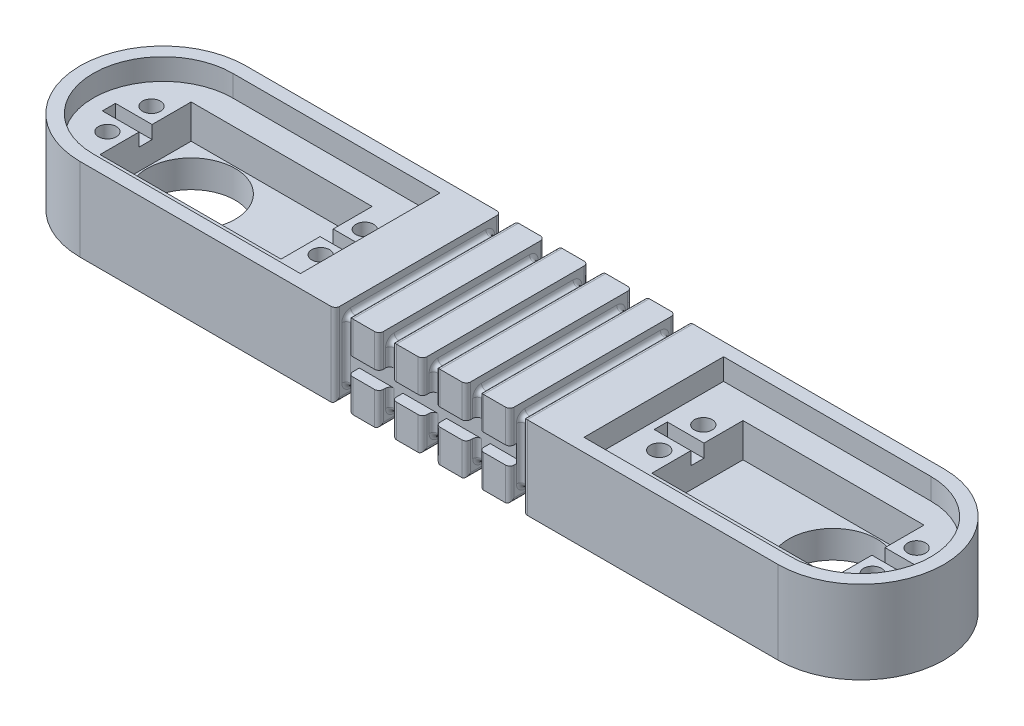
from build123d import *

# Parameters (mm, degrees)
EXTRUDE_1_DEPTH                    = 9.5
SKETCH_2_R                         = 2.05
SKETCH_2_W                         = 41.5
SKETCH_2_H                         = 20.9
CUT_EXTRUDE_1_DEPTH                = 4.9
SKETCH_2_3_W                       = 41.5
SKETCH_2_3_H                       = 20.9
SKETCH_2_3_R                       = 10.1
CUT_EXTRUDE_2_DEPTH                = 12.7
SKETCH_2_4_R                       = 2.05
SKETCH_2_4_R_2                     = 10.1
CUT_EXTRUDE_3_DEPTH                = 103.581674777
CUT_EXTRUDE_4_DEPTH                = 3.2
SKETCH_4_W                         = 8.4
SKETCH_4_H                         = 3
CUT_EXTRUDE_5_DEPTH                = 3
SKETCH_5_W                         = 38
SKETCH_5_H                         = 19
SKETCH_5_W_2                       = 33
SKETCH_5_H_2                       = 14
CUT_EXTRUDE_6_DEPTH                = 1.5
FILLET_1_R                         = 1
PATTERN_LINEAR_1_COUNT             = 3
PATTERN_LINEAR_1_PITCH             = 10
FILLET_1_OF_PATTERN_LINEAR_1_R     = 1
PATTERN_LINEAR_1_COL_COUNT         = 3
PATTERN_LINEAR_1_COL_PITCH         = 10
FILLET_1_OF_PATTERN_LINEAR_1_COL_R = 1
SKETCH_6_W                         = 37
SKETCH_6_H                         = 4
CUT_EXTRUDE_7_DEPTH                = 2.5


with BuildPart() as part:
    # 草图1 → 凸台-拉伸1 (new, symmetric)
    with BuildSketch(Plane(origin=(0, 0, 0), x_dir=(1, 0, 0), z_dir=(0, 1, 0))):
        with BuildLine():
            Line((-80, 19), (80, 19))
            ThreePointArc((80, 19), (99, 0), (80, -19))
            Line((80, -19), (-80, -19))
            ThreePointArc((-80, -19), (-99, 0), (-80, 19))
        make_face()
    extrude(amount=EXTRUDE_1_DEPTH, both=True)

    # 草图2 → 切除-拉伸1 (cut)
    # profile 1 of 2: a face of its own
    with BuildSketch(Plane(origin=(0, 9.5, 0), x_dir=(1, 0, 0), z_dir=(0, 1, 0))):
        with BuildLine():
            Line((-80, 16), (-32.5, 16))
            Line((-32.5, 16), (-32.5, -16))
            Line((-32.5, -16), (-80, -16))
            ThreePointArc((-80, -16), (-96, 0), (-80, 16))
        make_face()
        with Locations(Location((-38.8, -5.05, 0), (0, 0, 270))):
            Circle(SKETCH_2_R, mode=Mode.SUBTRACT)
        with Locations(Location((-38.8, 5.05, 0), (0, 0, 270))):
            Circle(SKETCH_2_R, mode=Mode.SUBTRACT)
        with Locations(Location((-87.7, -5.05, 0), (0, 0, 270))):
            Circle(SKETCH_2_R, mode=Mode.SUBTRACT)
        with Locations(Location((-87.7, 5.05, 0), (0, 0, 270))):
            Circle(SKETCH_2_R, mode=Mode.SUBTRACT)
        with Locations((-63.25, 0)):
            Rectangle(SKETCH_2_W, SKETCH_2_H, mode=Mode.SUBTRACT)
    # profile 2 of 2: a face of its own
    with BuildSketch(Plane(origin=(0, 9.5, 0), x_dir=(1, 0, 0), z_dir=(0, 1, 0))):
        with BuildLine():
            ThreePointArc((80, 16), (96, 0), (80, -16))
            Line((80, -16), (32.5, -16))
            Line((32.5, -16), (32.5, 16))
            Line((32.5, 16), (80, 16))
        make_face()
        with Locations(Location((87.7, -5.05, 0), (0, 0, 270))):
            Circle(SKETCH_2_R, mode=Mode.SUBTRACT)
        with Locations(Location((87.7, 5.05, 0), (0, 0, 270))):
            Circle(SKETCH_2_R, mode=Mode.SUBTRACT)
        with Locations(Location((38.8, -5.05, 0), (0, 0, 270))):
            Circle(SKETCH_2_R, mode=Mode.SUBTRACT)
        with Locations(Location((38.8, 5.05, 0), (0, 0, 270))):
            Circle(SKETCH_2_R, mode=Mode.SUBTRACT)
        with Locations((63.25, 0)):
            Rectangle(SKETCH_2_W, SKETCH_2_H, mode=Mode.SUBTRACT)
    extrude(amount=-CUT_EXTRUDE_1_DEPTH, mode=Mode.SUBTRACT)

    # 草图2<3> → 切除-拉伸2 (cut)
    # profile 1 of 2: a face of its own
    with BuildSketch(Plane(origin=(0, 9.5, 0), x_dir=(1, 0, 0), z_dir=(0, 1, 0))):
        with Locations((-63.25, 0)):
            Rectangle(SKETCH_2_3_W, SKETCH_2_3_H)
        with Locations(Location((-73.55, 0, 0), (0, 0, 270))):
            Circle(SKETCH_2_3_R, mode=Mode.SUBTRACT)
    # profile 2 of 2: a face of its own
    with BuildSketch(Plane(origin=(0, 9.5, 0), x_dir=(1, 0, 0), z_dir=(0, 1, 0))):
        with Locations((63.25, 0)):
            Rectangle(SKETCH_2_3_W, SKETCH_2_3_H)
        with Locations(Location((73.55, 0, 0), (0, 0, 270))):
            Circle(SKETCH_2_3_R, mode=Mode.SUBTRACT)
    extrude(amount=-CUT_EXTRUDE_2_DEPTH, mode=Mode.SUBTRACT)

    # 草图2<4> → 切除-拉伸3 (cut, through all)
    with BuildSketch(Plane(origin=(0, 9.5, 0), x_dir=(1, 0, 0), z_dir=(0, 1, 0))):
        with Locations(Location((-87.7, 5.05, 0), (0, 0, 270))):
            Circle(SKETCH_2_4_R)
        with Locations(Location((-87.7, -5.05, 0), (0, 0, 270))):
            Circle(SKETCH_2_4_R)
        with Locations(Location((-73.55, 0, 0), (0, 0, 270))):
            Circle(SKETCH_2_4_R_2)
        with Locations(Location((-38.8, 5.05, 0), (0, 0, 270))):
            Circle(SKETCH_2_4_R)
        with Locations(Location((-38.8, -5.05, 0), (0, 0, 270))):
            Circle(SKETCH_2_4_R)
        with Locations(Location((38.8, 5.05, 0), (0, 0, 270))):
            Circle(SKETCH_2_4_R)
        with Locations(Location((38.8, -5.05, 0), (0, 0, 270))):
            Circle(SKETCH_2_4_R)
        with Locations(Location((73.55, 0, 0), (0, 0, 270))):
            Circle(SKETCH_2_4_R_2)
        with Locations(Location((87.7, 5.05, 0), (0, 0, 270))):
            Circle(SKETCH_2_4_R)
        with Locations(Location((87.7, -5.05, 0), (0, 0, 270))):
            Circle(SKETCH_2_4_R)
    extrude(amount=-CUT_EXTRUDE_3_DEPTH, mode=Mode.SUBTRACT)

    # 草图3 → 切除-拉伸4 (cut)
    with BuildSketch(Plane.XZ.offset(9.5)):
        Polygon((-85.082857517, -1.970406105), (-83.724422212, -5.776714929), (-86.341564696, -8.856308823), (-90.317142483, -8.129593895), (-91.675577788, -4.323285071), (-89.058435304, -1.243691177), align=None)
        Polygon((-83.724422212, 5.776714929), (-86.341564696, 8.856308823), (-90.317142483, 8.129593895), (-91.675577788, 4.323285071), (-89.058435304, 1.243691177), (-85.082857517, 1.970406105), align=None)
        Polygon((83.724422212, -5.776714929), (86.341564696, -8.856308823), (90.317142483, -8.129593895), (91.675577788, -4.323285071), (89.058435304, -1.243691177), (85.082857517, -1.970406105), align=None)
        Polygon((85.082857517, 1.970406105), (83.724422212, 5.776714929), (86.341564696, 8.856308823), (90.317142483, 8.129593895), (91.675577788, 4.323285071), (89.058435304, 1.243691177), align=None)
        Polygon((-34.758548116, -5.05), (-36.779274058, -8.55), (-40.820725942, -8.55), (-42.841451884, -5.05), (-40.820725942, -1.55), (-36.779274058, -1.55), align=None)
        Polygon((-36.779274058, 8.55), (-40.820725942, 8.55), (-42.841451884, 5.05), (-40.820725942, 1.55), (-36.779274058, 1.55), (-34.758548116, 5.05), align=None)
        Polygon((36.779274058, -8.55), (40.820725942, -8.55), (42.841451884, -5.05), (40.820725942, -1.55), (36.779274058, -1.55), (34.758548116, -5.05), align=None)
        Polygon((34.758548116, 5.05), (36.779274058, 8.55), (40.820725942, 8.55), (42.841451884, 5.05), (40.820725942, 1.55), (36.779274058, 1.55), align=None)
    extrude(amount=-CUT_EXTRUDE_4_DEPTH, mode=Mode.SUBTRACT)

    # 草图4 → 切除-拉伸5 (cut)
    with BuildSketch(Plane(origin=(0, 4.6, 0), x_dir=(1, 0, 0), z_dir=(0, 1, 0))):
        with Locations((-38.3, 0)):
            Rectangle(SKETCH_4_W, SKETCH_4_H)
        with Locations((-88.2, 0)):
            Rectangle(SKETCH_4_W, SKETCH_4_H)
        with Locations((88.2, 0)):
            Rectangle(SKETCH_4_W, SKETCH_4_H)
        with Locations((38.3, 0)):
            Rectangle(SKETCH_4_W, SKETCH_4_H)
    extrude(amount=-CUT_EXTRUDE_5_DEPTH, mode=Mode.SUBTRACT)

    # 草图5 → 切除-拉伸6 (cut, symmetric)
    with BuildSketch(Plane(origin=(0, 0, 0), x_dir=(0, 0, -1), z_dir=(1, 0, 0))):
        Rectangle(SKETCH_5_W, SKETCH_5_H)
        Rectangle(SKETCH_5_W_2, SKETCH_5_H_2, mode=Mode.SUBTRACT)
    cut_extrude_6 = extrude(amount=CUT_EXTRUDE_6_DEPTH, both=True, mode=Mode.SUBTRACT)

    # 圆角1
    fillet_1_edges = [part.edges().sort_by_distance(p)[0] for p in [
        (-1.5, 0, 19),
        (-1.5, 0, -19),
        (-1.5, -9.5, 0),
        (-1.5, 7, 0),
        (-1.5, 0, 16.5),
        (-1.5, -7, 0),
        (-1.5, 0, -16.5),
        (1.5, 0, 19),
        (1.5, -9.5, 0),
        (1.5, 0, -19),
        (1.5, 9.5, 0),
        (0, 7, 16.5),
        (0, 7, -16.5),
        (0, -7, -16.5),
        (0, -7, 16.5),
    ]]
    fillet(fillet_1_edges, radius=FILLET_1_R)

    # 阵列(线性)1: 切除-拉伸6 ×3
    with Locations(*[(-i * PATTERN_LINEAR_1_PITCH, 0, 0) for i in range(1, PATTERN_LINEAR_1_COUNT)]):
        add(cut_extrude_6, mode=Mode.SUBTRACT)

    # 圆角1 of 阵列(线性)1
    fillet_1_of_pattern_linear_1_edges = [part.edges().sort_by_distance(p)[0] for p in [
        (-11.5, 0, 19),
        (-11.5, 0, -19),
        (-11.5, -9.5, 0),
        (-11.5, 7, 0),
        (-11.5, 0, 16.5),
        (-11.5, -7, 0),
        (-11.5, 0, -16.5),
        (-8.5, 0, 19),
        (-8.5, -9.5, 0),
        (-8.5, 0, -19),
        (-8.5, 9.5, 0),
        (-10, 7, 16.5),
        (-10, 7, -16.5),
        (-10, -7, -16.5),
        (-10, -7, 16.5),
        (-21.5, 0, 19),
        (-21.5, 0, -19),
        (-21.5, -9.5, 0),
        (-21.5, 7, 0),
        (-21.5, 0, 16.5),
        (-21.5, -7, 0),
        (-21.5, 0, -16.5),
        (-18.5, 0, 19),
        (-18.5, -9.5, 0),
        (-18.5, 0, -19),
        (-18.5, 9.5, 0),
        (-20, 7, 16.5),
        (-20, 7, -16.5),
        (-20, -7, -16.5),
        (-20, -7, 16.5),
    ]]
    fillet(fillet_1_of_pattern_linear_1_edges, radius=FILLET_1_OF_PATTERN_LINEAR_1_R)

    # 阵列(线性)1 col: 切除-拉伸6 ×3
    with Locations(*[(i * PATTERN_LINEAR_1_COL_PITCH, 0, 0) for i in range(1, PATTERN_LINEAR_1_COL_COUNT)]):
        add(cut_extrude_6, mode=Mode.SUBTRACT)

    # 圆角1 of 阵列(线性)1 col
    fillet_1_of_pattern_linear_1_col_edges = [part.edges().sort_by_distance(p)[0] for p in [
        (8.5, 0, 19),
        (8.5, 0, -19),
        (8.5, -9.5, 0),
        (8.5, 7, 0),
        (8.5, 0, 16.5),
        (8.5, -7, 0),
        (8.5, 0, -16.5),
        (11.5, 0, 19),
        (11.5, -9.5, 0),
        (11.5, 0, -19),
        (11.5, 9.5, 0),
        (10, 7, 16.5),
        (10, 7, -16.5),
        (10, -7, -16.5),
        (10, -7, 16.5),
        (18.5, 0, 19),
        (18.5, 0, -19),
        (18.5, -9.5, 0),
        (18.5, 7, 0),
        (18.5, 0, 16.5),
        (18.5, -7, 0),
        (18.5, 0, -16.5),
        (21.5, 0, 19),
        (21.5, -9.5, 0),
        (21.5, 0, -19),
        (21.5, 9.5, 0),
        (20, 7, 16.5),
        (20, 7, -16.5),
        (20, -7, -16.5),
        (20, -7, 16.5),
    ]]
    fillet(fillet_1_of_pattern_linear_1_col_edges, radius=FILLET_1_OF_PATTERN_LINEAR_1_COL_R)

    # 草图6 → 切除-拉伸7 (cut)
    with BuildSketch(Plane(origin=(0, 0, -19), x_dir=(-1, 0, 0), z_dir=(0, 0, -1))):
        Rectangle(SKETCH_6_W, SKETCH_6_H)
    cut_extrude_7 = extrude(amount=-CUT_EXTRUDE_7_DEPTH, mode=Mode.SUBTRACT)

    # 镜向2: 切除-拉伸7 across plane
    add(cut_extrude_7.mirror(Plane.XY), mode=Mode.SUBTRACT)


solid = part.part
